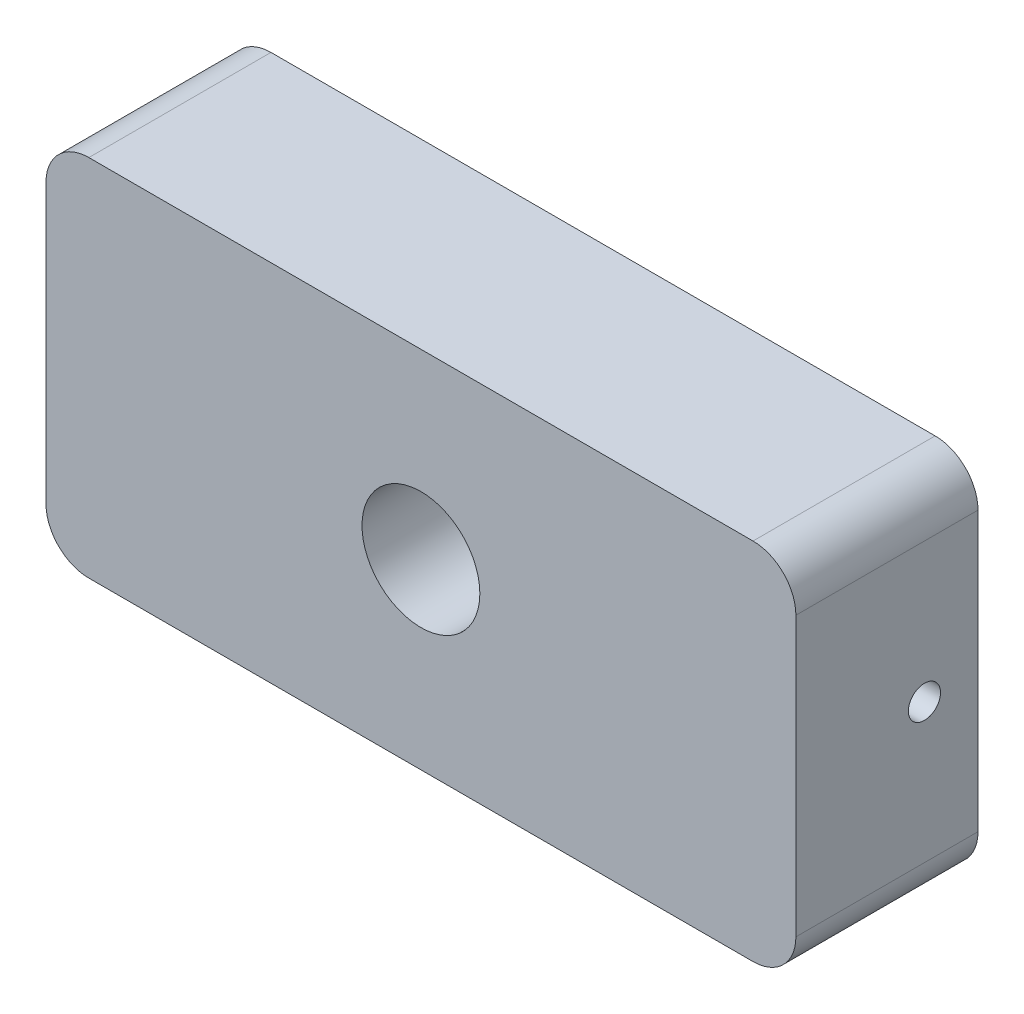
from build123d import *

# Parameters (mm, degrees)
CROQUIS1_W              = 70
CROQUIS1_H              = 34
CROQUIS1_R              = 11.2
CROQUIS1_R_2            = 4.1
SALIENTE_EXTRUIR1_DEPTH = 9
CROQUIS2_W              = 70
CROQUIS2_H              = 34
CROQUIS2_R              = 5.5
SALIENTE_EXTRUIR2_DEPTH = 8
CUT_EXTRUDE1_REACH      = 92.756
CUT_EXTRUDE1_END_RADIUS = 4.1
SKETCH1_R               = 1.5
CUT_EXTRUDE2_REACH      = 92.756
CUT_EXTRUDE2_END_RADIUS = 4.1
SKETCH2_R               = 1.5
FILLET1_R               = 4


with BuildPart() as part:
    # Croquis1 → Saliente-Extruir1 (new body)
    with BuildSketch(Plane.XY):
        with Locations((229.019677403, 38.205269585)):
            Rectangle(CROQUIS1_W, CROQUIS1_H)
        with Locations((229.019677403, 38.205269585)):
            Circle(CROQUIS1_R, mode=Mode.SUBTRACT)
        with Locations((201.319677403, 38.205269585)):
            Circle(CROQUIS1_R_2, mode=Mode.SUBTRACT)
        with Locations(Location((256.719677403, 38.205269585, 0), (0, 0, 180))):
            Circle(CROQUIS1_R_2, mode=Mode.SUBTRACT)
    extrude(amount=SALIENTE_EXTRUIR1_DEPTH)

    # Croquis2 → Saliente-Extruir2 (add)
    with BuildSketch(Plane.XY.offset(9)):
        with Locations((229.019677403, 38.205269585)):
            Rectangle(CROQUIS2_W, CROQUIS2_H)
        with Locations((229.019677403, 38.205269585)):
            Circle(CROQUIS2_R, mode=Mode.SUBTRACT)
    extrude(amount=SALIENTE_EXTRUIR2_DEPTH)

    # Cut-Extrude1: up to this cylinder (the profile starts outside it)
    cut_extrude1_end = Plane(origin=(201.319677403, 38.205269585, 5), z_dir=(0, 0, -1)) * Cylinder(CUT_EXTRUDE1_END_RADIUS, 194.712, mode=Mode.PRIVATE)
    # Sketch1 → Cut-Extrude1 (cut, up to the surface)
    with BuildSketch(Plane.ZY.offset(-194.019677403), mode=Mode.PRIVATE) as cut_extrude1_sk1:
        with Locations((5, 37.981969781)):
            Circle(SKETCH1_R)
    cut_extrude1_tool1 = extrude(cut_extrude1_sk1.sketch, amount=-CUT_EXTRUDE1_REACH, mode=Mode.PRIVATE) - cut_extrude1_end
    add(cut_extrude1_tool1.solids().sort_by_distance((194.019677, 37.98197, 5))[0], mode=Mode.SUBTRACT)

    # Cut-Extrude2: up to this cylinder (the profile starts outside it)
    cut_extrude2_end = Plane(origin=(256.719677403, 38.205269585, 5), z_dir=(0, 0, -1)) * Cylinder(CUT_EXTRUDE2_END_RADIUS, 194.712, mode=Mode.PRIVATE)
    # Sketch2 → Cut-Extrude2 (cut, up to the surface)
    with BuildSketch(Plane(origin=(264.019677403, 0, 0), x_dir=(0, 0, -1), z_dir=(1, 0, 0)), mode=Mode.PRIVATE) as cut_extrude2_sk1:
        with Locations((-5, 38.205269585)):
            Circle(SKETCH2_R)
    cut_extrude2_tool1 = extrude(cut_extrude2_sk1.sketch, amount=-CUT_EXTRUDE2_REACH, mode=Mode.PRIVATE) - cut_extrude2_end
    add(cut_extrude2_tool1.solids().sort_by_distance((264.019677, 38.20527, 5))[0], mode=Mode.SUBTRACT)

    # Fillet1
    fillet1_edges = [part.edges().sort_by_distance(p)[0] for p in [
        (194.019677403, 55.205269585, 8.5),
        (264.019677403, 55.205269585, 8.5),
        (264.019677403, 21.205269585, 8.5),
        (194.019677403, 21.205269585, 8.5),
    ]]
    fillet(fillet1_edges, radius=FILLET1_R)


solid = part.part
